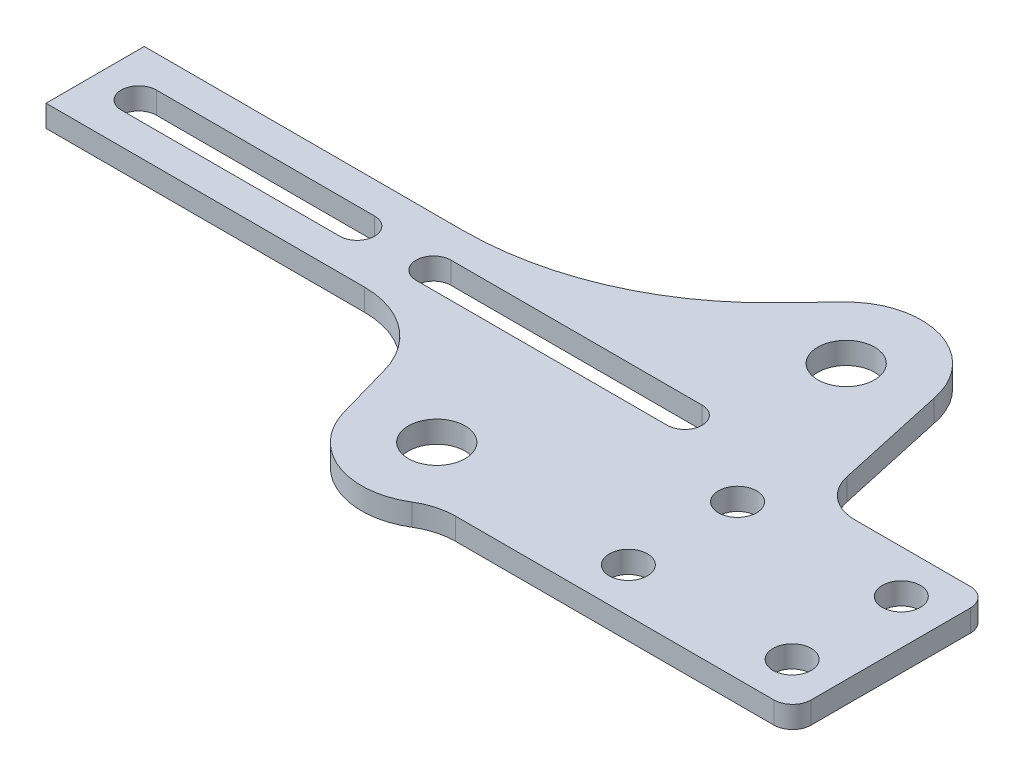
from build123d import *

# Parameters (mm, degrees)
SKETCH_2_R          = 2.6
SKETCH_2_R_2        = 1.75
EXTRUDE_3_DEPTH     = 2
EXTRUDE_START       = -2
SKETCH_3_R          = 2.6
EXTRUDE_4_DEPTH     = 2
EXTRUDE_5_DEPTH     = 2
FILLET_1_R          = 6
CUT_EXTRUDE_1_DEPTH = 2
EXTRUDE_6_DEPTH     = 2
SKETCH_8_W          = 26
SKETCH_8_H          = 9
EXTRUDE_7_DEPTH     = 2


with BuildPart() as part:
    # 草图2 → 凸台-拉伸3 (new body)
    with BuildSketch(Plane(origin=(0, 0, 0), x_dir=(1, 0, 0), z_dir=(0, 1, 0))):
        Polygon((15, 14), (-1.25, 14), (-1.25, 31.003525978), (-10.75, 31.003525978), (-10.75, 19.003525978), (-37.293472201, 19.003525978), (-37.293472201, 10.003525978), (-23.25, 10.003525978), (-23.25, -3.996474022), (-13.75, -3.996474022), (15, -3.996474022), (17.373946176, -3.996474022), (17.373946176, 14), align=None)
        with Locations(Location((-18.5, 1.003525978, 0), (0, 0, 270))):
            Circle(SKETCH_2_R, mode=Mode.SUBTRACT)
        with Locations(Location((0, 0.053173587, 0), (0, 0, 270))):
            Circle(SKETCH_2_R_2, mode=Mode.SUBTRACT)
        with Locations(Location((15, 0.053173587, 0), (0, 0, 270))):
            Circle(SKETCH_2_R_2, mode=Mode.SUBTRACT)
        with Locations(Location((0, 10.053173587, 0), (0, 0, 270))):
            Circle(SKETCH_2_R_2, mode=Mode.SUBTRACT)
        with Locations(Location((15, 10.053173587, 0), (0, 0, 270))):
            Circle(SKETCH_2_R_2, mode=Mode.SUBTRACT)
        with Locations(Location((-6, 26.003525978, 0), (0, 0, 270))):
            Circle(SKETCH_2_R, mode=Mode.SUBTRACT)
    extrude(amount=EXTRUDE_3_DEPTH)

    # 草图3 → 凸台-拉伸4 (add)
    # profile 1 of 9: a face of its own
    with BuildSketch(Plane(origin=(0, 2, 0), x_dir=(1, 0, 0), z_dir=(0, 1, 0)).offset(EXTRUDE_START)):
        with BuildLine():
            Line((-1.25, 31.003525978), (-10.75, 31.003525978))
            Line((-10.75, 31.003525978), (-10.75, 21.003525978))
            ThreePointArc((-10.75, 21.003525978), (-8.557314455, 19.59863388), (-6, 19.106968866))
            ThreePointArc((-6, 19.106968866), (-3.442685545, 19.59863388), (-1.25, 21.003525978))
            Line((-1.25, 21.003525978), (-1.25, 31.003525978))
        make_face()
        with Locations(Location((-6, 26.003525978, 0), (0, 0, 270))):
            Circle(SKETCH_3_R, mode=Mode.SUBTRACT)
    # profile 2 of 9: a face of its own
    with BuildSketch(Plane(origin=(0, 2, 0), x_dir=(1, 0, 0), z_dir=(0, 1, 0)).offset(EXTRUDE_START)):
        with BuildLine():
            ThreePointArc((-10.75, 21.003525978), (-12.895048442, 25.85927974), (-10.9549552, 30.800495747))
            Line((-10.9549552, 30.800495747), (-14.196613842, 27.452074948))
            ThreePointArc((-14.196613842, 27.452074948), (-23.307699904, 21.20281017), (-34.134904, 19.003525978))
            Line((-34.134904, 19.003525978), (-10.75, 19.003525978))
            Line((-10.75, 19.003525978), (-10.75, 21.003525978))
        make_face()
    # profile 3 of 9: a face of its own
    with BuildSketch(Plane(origin=(0, 2, 0), x_dir=(1, 0, 0), z_dir=(0, 1, 0)).offset(EXTRUDE_START)):
        with BuildLine():
            ThreePointArc((-1.25, 31.003525978), (-6, 32.90008309), (-10.75, 31.003525978))
            Line((-10.75, 31.003525978), (-1.25, 31.003525978))
        make_face()
    # profile 4 of 9: a face of its own
    with BuildSketch(Plane(origin=(0, 2, 0), x_dir=(1, 0, 0), z_dir=(0, 1, 0)).offset(EXTRUDE_START)):
        with BuildLine():
            ThreePointArc((0.896557112, 26.003525978), (0.337237027, 28.72417422), (-1.25, 31.003525978))
            Line((-1.25, 31.003525978), (-1.25, 21.003525978))
            ThreePointArc((-1.25, 21.003525978), (0.337237027, 23.282877735), (0.896557112, 26.003525978))
        make_face()
    # profile 5 of 9: a face of its own
    with BuildSketch(Plane(origin=(0, 2, 0), x_dir=(1, 0, 0), z_dir=(0, 1, 0)).offset(EXTRUDE_START)):
        with BuildLine():
            Line((-26.624271801, 4.358914994), (-25.133517426, -0.882991066))
            ThreePointArc((-25.133517426, -0.882991066), (-25.152228686, 2.822963667), (-23.25, 6.003525978))
            Line((-23.25, 6.003525978), (-23.25, 10.003525978))
            Line((-23.25, 10.003525978), (-34.097989538, 10.003525978))
            ThreePointArc((-34.097989538, 10.003525978), (-29.415092732, 8.433817083), (-26.624271801, 4.358914994))
        make_face()
    # profile 6 of 9: a face of its own
    with BuildSketch(Plane(origin=(0, 2, 0), x_dir=(1, 0, 0), z_dir=(0, 1, 0)).offset(EXTRUDE_START)):
        with BuildLine():
            ThreePointArc((-11.603442888, 1.003525978), (-15.779351758, 7.340763005), (-23.25, 6.003525978))
            Line((-23.25, 6.003525978), (-23.25, -3.996474022))
            Line((-23.25, -3.996474022), (-13.75, -3.996474022))
            ThreePointArc((-13.75, -3.996474022), (-12.162762973, -1.717122265), (-11.603442888, 1.003525978))
        make_face()
        with Locations(Location((-18.5, 1.003525978, 0), (0, 0, 270))):
            Circle(SKETCH_3_R, mode=Mode.SUBTRACT)
    # profile 7 of 9: a face of its own
    with BuildSketch(Plane(origin=(0, 2, 0), x_dir=(1, 0, 0), z_dir=(0, 1, 0)).offset(EXTRUDE_START)):
        with BuildLine():
            ThreePointArc((-23.25, 6.003525978), (-25.152228686, 2.822963667), (-25.133517426, -0.882991066))
            ThreePointArc((-25.133517426, -0.882991066), (-24.400810222, -2.566199323), (-23.25, -3.996474022))
            Line((-23.25, -3.996474022), (-23.25, 6.003525978))
        make_face()
    # profile 8 of 9: a face of its own
    with BuildSketch(Plane(origin=(0, 2, 0), x_dir=(1, 0, 0), z_dir=(0, 1, 0)).offset(EXTRUDE_START)):
        with BuildLine():
            Line((-13.75, -3.996474022), (-23.25, -3.996474022))
            ThreePointArc((-23.25, -3.996474022), (-18.5, -5.893031134), (-13.75, -3.996474022))
        make_face()
    # profile 9 of 9: a face of its own
    with BuildSketch(Plane(origin=(0, 2, 0), x_dir=(1, 0, 0), z_dir=(0, 1, 0)).offset(EXTRUDE_START)):
        with BuildLine():
            ThreePointArc((-10.75, 31.003525978), (-10.853539345, 30.903082674), (-10.9549552, 30.800495747))
            ThreePointArc((-10.9549552, 30.800495747), (-12.895048442, 25.85927974), (-10.75, 21.003525978))
            Line((-10.75, 21.003525978), (-10.75, 31.003525978))
        make_face()
    extrude(amount=EXTRUDE_4_DEPTH)

    # 草图4 → 凸台-拉伸5 (add)
    with BuildSketch(Plane.XZ):
        with BuildLine():
            ThreePointArc((-1.25, -21.003525978), (0.561593491, -23.880323006), (0.778699813, -27.273064812))
            Line((0.778699813, -27.273064812), (3.023667629, -17.033583157))
            ThreePointArc((3.023667629, -17.033583157), (4.374639496, -14.852535674), (6.79440726, -14))
            Line((6.79440726, -14), (-1.25, -14))
            Line((-1.25, -14), (-1.25, -21.003525978))
        make_face()
    extrude(amount=-EXTRUDE_5_DEPTH)

    # 圆角1
    fillet_1_edges = [part.edges().sort_by_distance(p)[0] for p in [
        (-13.75, 1, 3.996474022),
    ]]
    fillet(fillet_1_edges, radius=FILLET_1_R)

    # 草图6 → 切除-拉伸1 (cut)
    with BuildSketch(Plane(origin=(0, 2, 0), x_dir=(1, 0, 0), z_dir=(0, 1, 0))):
        with BuildLine():
            Line((-32.293472201, 12.903525978), (-9.293472201, 12.903525978))
            ThreePointArc((-9.293472201, 12.903525978), (-7.693472201, 14.503525978), (-9.293472201, 16.103525978))
            Line((-9.293472201, 16.103525978), (-32.293472201, 16.103525978))
            ThreePointArc((-32.293472201, 16.103525978), (-33.893472201, 14.503525978), (-32.293472201, 12.903525978))
        make_face()
    extrude(amount=-CUT_EXTRUDE_1_DEPTH, mode=Mode.SUBTRACT)

    # 草图7 → 凸台-拉伸6 (add)
    with BuildSketch(Plane(origin=(0, 2, 0), x_dir=(1, 0, 0), z_dir=(0, 1, 0))):
        with BuildLine():
            Line((19.085277426, 12.28866875), (19.085277426, -2.285142773))
            ThreePointArc((19.085277426, -2.285142773), (18.584040107, -3.495236704), (17.373946176, -3.996474022))
            Line((17.373946176, -3.996474022), (17.373946176, 14))
            ThreePointArc((17.373946176, 14), (18.584040107, 13.498762682), (19.085277426, 12.28866875))
        make_face()
    extrude(amount=-EXTRUDE_6_DEPTH)

    # 草图8 → 凸台-拉伸7 (add)
    with BuildSketch(Plane(origin=(0, 2, 0), x_dir=(1, 0, 0), z_dir=(0, 1, 0))):
        with Locations((-50.293472201, 14.503525978)):
            Rectangle(SKETCH_8_W, SKETCH_8_H)
        with BuildLine():
            ThreePointArc((-39.293472201, 12.903525978), (-37.693472201, 14.503525978), (-39.293472201, 16.103525978))
            Line((-39.293472201, 16.103525978), (-59.293472201, 16.103525978))
            ThreePointArc((-59.293472201, 16.103525978), (-60.893472201, 14.503525978), (-59.293472201, 12.903525978))
            Line((-59.293472201, 12.903525978), (-39.293472201, 12.903525978))
        make_face(mode=Mode.SUBTRACT)
    extrude(amount=-EXTRUDE_7_DEPTH)


solid = part.part
